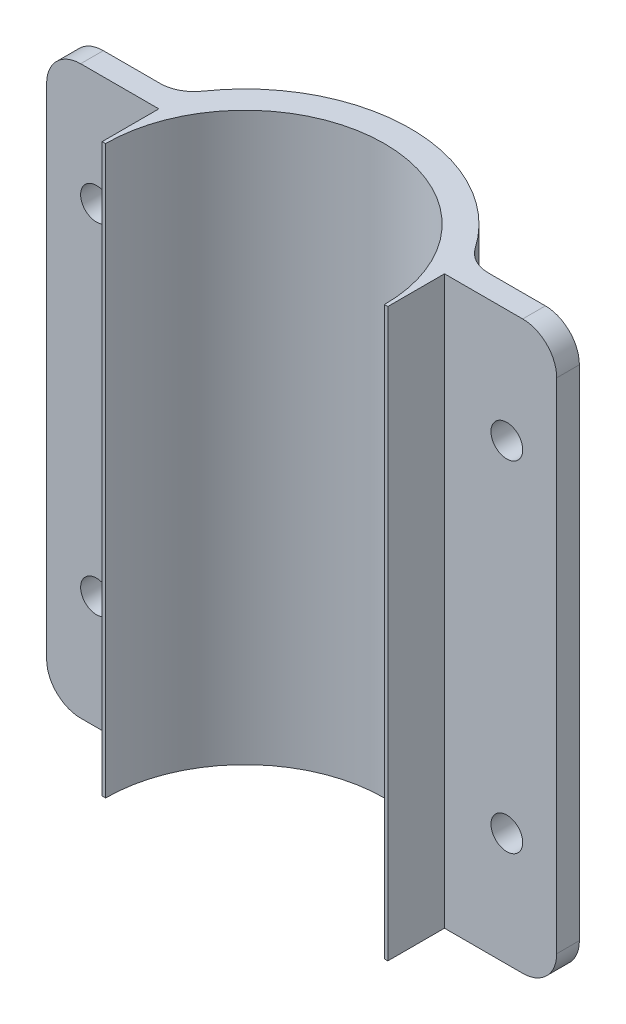
from build123d import *

# Parameters (mm, degrees)
BOSS_EXTRUDE1_DEPTH = 50
SKETCH2_R           = 1.4
CUT_EXTRUDE3_DEPTH  = 2
FILLET2_R           = 3


with BuildPart() as part:
    # Sketch1 → Boss-Extrude1 (new body)
    with BuildSketch(Plane(origin=(0, 0, 0), x_dir=(1, 0, 0), z_dir=(0, 1, 0))):
        with BuildLine():
            Line((-12.6, 0), (-12.6, 5))
            Line((-12.6, 5), (-22.5, 5))
            Line((-22.5, 5), (-22.5, 7))
            Line((-22.5, 7), (-22.1, 7))
            Line((-22.1, 7), (-14.483093592, 7))
            ThreePointArc((-14.483093592, 7), (-13.089113026, 7.343532763), (-12.014384457, 8.295454545))
            ThreePointArc((-12.014384457, 8.295454545), (0, 14.6), (12.014384457, 8.295454545))
            ThreePointArc((12.014384457, 8.295454545), (13.089113026, 7.343532763), (14.483093592, 7))
            Line((14.483093592, 7), (22.1, 7))
            Line((22.1, 7), (22.5, 7))
            Line((22.5, 7), (22.5, 5))
            Line((22.5, 5), (12.6, 5))
            Line((12.6, 5), (12.6, 0))
            Line((12.6, 0), (12.3, 0))
            ThreePointArc((12.3, 0), (0, 12.3), (-12.3, 0))
            Line((-12.3, 0), (-12.6, 0))
        make_face()
    extrude(amount=BOSS_EXTRUDE1_DEPTH)

    # Sketch2 → Cut-Extrude3 (cut)
    with BuildSketch(Plane(origin=(0, 0, -7), x_dir=(-1, 0, 0), z_dir=(0, 0, -1))):
        with Locations((-18.1, 10)):
            Circle(SKETCH2_R)
        with Locations(Location((-18.1, 40, 0), (0, 0, 180))):
            Circle(SKETCH2_R)
        with Locations((18.1, 40)):
            Circle(SKETCH2_R)
        with Locations(Location((18.1, 10, 0), (0, 0, 180))):
            Circle(SKETCH2_R)
    extrude(amount=-CUT_EXTRUDE3_DEPTH, mode=Mode.SUBTRACT)

    # Fillet2
    fillet2_edges = [part.edges().sort_by_distance(p)[0] for p in [
        (-22.5, 0, -6),
        (22.5, 0, -6),
        (22.5, 50, -6),
        (-22.5, 50, -6),
    ]]
    fillet(fillet2_edges, radius=FILLET2_R)


solid = part.part
